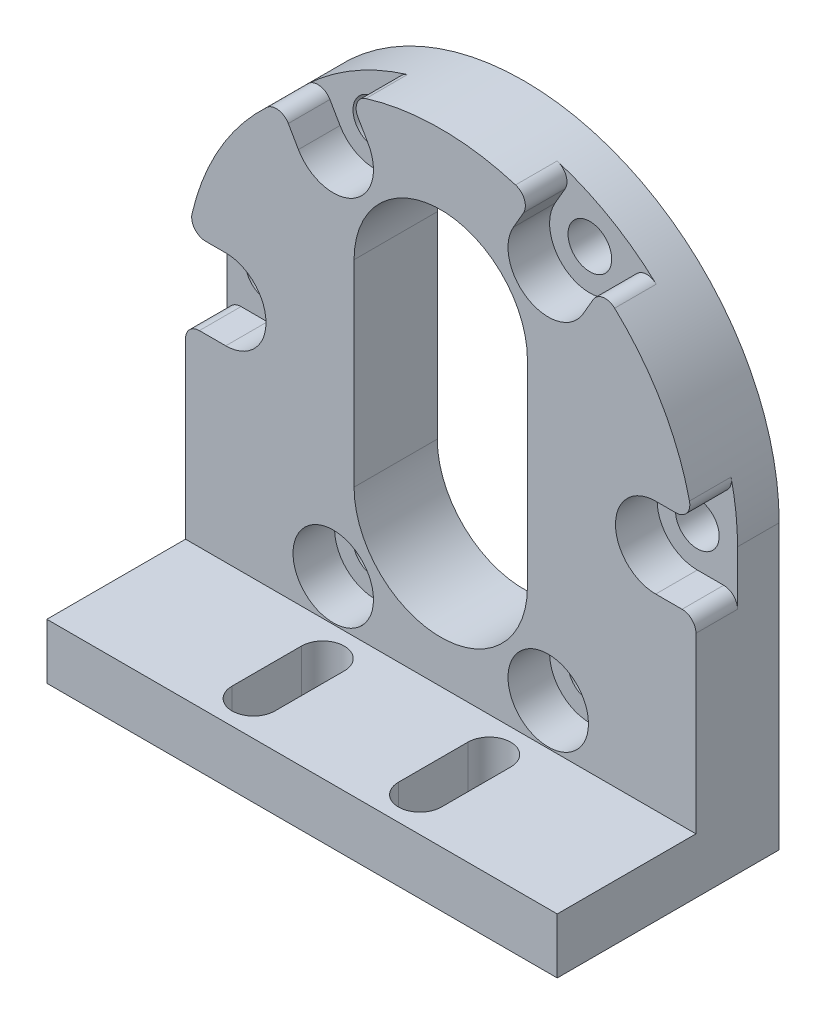
from build123d import *

# Parameters (mm, degrees)
SKETCH1_R           = 1.575
BOSS_EXTRUDE1_DEPTH = 6
CUT_EXTRUDE3_START  = -3
SKETCH2_R           = 2.9
SKETCH2_R_2         = 1.575
CUT_EXTRUDE3_DEPTH  = 3
CUT_EXTRUDE4_START  = -3
SKETCH2_3_R         = 2.9
SKETCH2_3_R_2       = 1.575
CUT_EXTRUDE4_DEPTH  = 3
SKETCH3_W           = 36.8
SKETCH3_H           = 4
BOSS_EXTRUDE2_DEPTH = 16
CUT_EXTRUDE5_DEPTH  = 10
FILLET2_R           = 1


with BuildPart() as part:
    # Sketch1 → Boss-Extrude1 (new body)
    # profile 1 of 2: a face of its own
    with BuildSketch(Plane.XY):
        with BuildLine():
            ThreePointArc((18.4, 0), (0, 18.4), (-18.4, 0))
            ThreePointArc((-18.4, 0), (0, -18.4), (18.4, 0))
        make_face()
        with Locations((-7.75, -13.423393759)):
            Circle(SKETCH1_R, mode=Mode.SUBTRACT)
        with Locations((7.75, -13.423393759)):
            Circle(SKETCH1_R, mode=Mode.SUBTRACT)
        with Locations((-15.5, 0)):
            Circle(SKETCH1_R, mode=Mode.SUBTRACT)
        with Locations((-7.75, 13.423393759)):
            Circle(SKETCH1_R, mode=Mode.SUBTRACT)
        with BuildLine():
            ThreePointArc((6.25, -7.1), (0, -13.35), (-6.25, -7.1))
            Line((-6.25, -7.1), (-6.25, 7.1))
            ThreePointArc((-6.25, 7.1), (0, 13.35), (6.25, 7.1))
            Line((6.25, 7.1), (6.25, -7.1))
        make_face(mode=Mode.SUBTRACT)
        with Locations((15.5, 0)):
            Circle(SKETCH1_R, mode=Mode.SUBTRACT)
        with Locations((7.75, 13.423393759)):
            Circle(SKETCH1_R, mode=Mode.SUBTRACT)
    # profile 2 of 2: a face of its own
    with BuildSketch(Plane.XY):
        with BuildLine():
            ThreePointArc((18.4, 0), (0, -18.4), (-18.4, 0))
            Line((-18.4, 0), (-18.4, -19))
            Line((-18.4, -19), (18.4, -19))
            Line((18.4, -19), (18.4, 0))
        make_face()
    extrude(amount=BOSS_EXTRUDE1_DEPTH)

    # Sketch2 → Cut-Extrude3 (cut)
    # profile 1 of 12: a face of its own
    with BuildSketch(Plane.XY.offset(6).offset(CUT_EXTRUDE3_START)):
        with Locations((-15.5, 0)):
            Circle(SKETCH2_R)
        with Locations((-15.5, 0)):
            Circle(SKETCH2_R_2, mode=Mode.SUBTRACT)
    # profile 2 of 12: a face of its own
    with BuildSketch(Plane.XY.offset(6).offset(CUT_EXTRUDE3_START)):
        with BuildLine():
            ThreePointArc((-18.4, 0), (-17.550609665, 2.050609665), (-15.5, 2.9))
            Line((-15.5, 2.9), (-18.17003027, 2.9))
            ThreePointArc((-18.17003027, 2.9), (-18.342417466, 1.454551999), (-18.4, 0))
        make_face()
    # profile 3 of 12: a face of its own
    with BuildSketch(Plane.XY.offset(6).offset(CUT_EXTRUDE3_START)):
        with BuildLine():
            ThreePointArc((-15.5, -2.9), (-17.550609665, -2.050609665), (-18.4, 0))
            Line((-18.4, 0), (-18.4, -2.9))
            Line((-18.4, -2.9), (-15.5, -2.9))
        make_face()
    # profile 4 of 12: a face of its own
    with BuildSketch(Plane.XY.offset(6).offset(CUT_EXTRUDE3_START)):
        with BuildLine():
            ThreePointArc((-6.573541464, 17.185707801), (-7.911529831, 16.612275453), (-9.200000154, 15.934867341))
            ThreePointArc((-9.200000154, 15.934867341), (-6.999424855, 16.224578678), (-5.238526329, 14.873393759))
            Line((-5.238526329, 14.873393759), (-6.573541464, 17.185707801))
        make_face()
    # profile 5 of 12: a face of its own
    with BuildSketch(Plane.XY.offset(6).offset(CUT_EXTRUDE3_START)):
        with BuildLine():
            ThreePointArc((-9.200000154, 15.934867341), (-10.430887789, 15.157723442), (-11.596488806, 14.285707801))
            Line((-11.596488806, 14.285707801), (-10.261473671, 11.973393759))
            ThreePointArc((-10.261473671, 11.973393759), (-10.551184919, 14.173968903), (-9.200000154, 15.934867341))
        make_face()
    # profile 6 of 12: a face of its own
    with BuildSketch(Plane.XY.offset(6).offset(CUT_EXTRUDE3_START)):
        with Locations((-7.75, 13.423393759)):
            Circle(SKETCH2_R)
        with Locations((-7.75, 13.423393759)):
            Circle(SKETCH2_R_2, mode=Mode.SUBTRACT)
    # profile 7 of 12: a face of its own
    with BuildSketch(Plane.XY.offset(6).offset(CUT_EXTRUDE3_START)):
        with BuildLine():
            ThreePointArc((9.200000155, 15.93486734), (7.911529831, 16.612275453), (6.573541464, 17.185707801))
            Line((6.573541464, 17.185707801), (5.238526329, 14.873393759))
            ThreePointArc((5.238526329, 14.873393759), (6.999424856, 16.224578678), (9.200000155, 15.93486734))
        make_face()
    # profile 8 of 12: a face of its own
    with BuildSketch(Plane.XY.offset(6).offset(CUT_EXTRUDE3_START)):
        with Locations((7.75, 13.423393759)):
            Circle(SKETCH2_R)
        with Locations((7.75, 13.423393759)):
            Circle(SKETCH2_R_2, mode=Mode.SUBTRACT)
    # profile 9 of 12: a face of its own
    with BuildSketch(Plane.XY.offset(6).offset(CUT_EXTRUDE3_START)):
        with BuildLine():
            ThreePointArc((11.596488806, 14.285707801), (10.430887789, 15.157723441), (9.200000155, 15.93486734))
            ThreePointArc((9.200000155, 15.93486734), (10.261473716, 14.873393681), (10.65, 13.423393759))
            ThreePointArc((10.65, 13.423393759), (10.551184896, 12.672818528), (10.261473671, 11.973393759))
            Line((10.261473671, 11.973393759), (11.596488806, 14.285707801))
        make_face()
    # profile 10 of 12: a face of its own
    with BuildSketch(Plane.XY.offset(6).offset(CUT_EXTRUDE3_START)):
        with BuildLine():
            ThreePointArc((18.4, 0), (18.342417466, 1.454551999), (18.17003027, 2.9))
            Line((18.17003027, 2.9), (15.5, 2.9))
            ThreePointArc((15.5, 2.9), (17.550609665, 2.050609665), (18.4, 0))
        make_face()
    # profile 11 of 12: a face of its own
    with BuildSketch(Plane.XY.offset(6).offset(CUT_EXTRUDE3_START)):
        with Locations((15.5, 0)):
            Circle(SKETCH2_R)
        with Locations((15.5, 0)):
            Circle(SKETCH2_R_2, mode=Mode.SUBTRACT)
    # profile 12 of 12: a face of its own
    with BuildSketch(Plane.XY.offset(6).offset(CUT_EXTRUDE3_START)):
        with BuildLine():
            Line((18.4, -2.9), (18.4, 0))
            ThreePointArc((18.4, 0), (17.550609665, -2.050609665), (15.5, -2.9))
            Line((15.5, -2.9), (18.4, -2.9))
        make_face()
    extrude(amount=CUT_EXTRUDE3_DEPTH, mode=Mode.SUBTRACT)

    # Sketch2<3> → Cut-Extrude4 (cut)
    # profile 1 of 2: a face of its own
    with BuildSketch(Plane.XY.offset(6).offset(CUT_EXTRUDE4_START)):
        with Locations((7.75, -13.423393759)):
            Circle(SKETCH2_3_R)
        with Locations((7.75, -13.423393759)):
            Circle(SKETCH2_3_R_2, mode=Mode.SUBTRACT)
    # profile 2 of 2: a face of its own
    with BuildSketch(Plane.XY.offset(6).offset(CUT_EXTRUDE4_START)):
        with Locations((-7.75, -13.423393759)):
            Circle(SKETCH2_3_R)
    extrude(amount=CUT_EXTRUDE4_DEPTH, mode=Mode.SUBTRACT)

    # Sketch3 → Boss-Extrude2 (add)
    with BuildSketch(Plane.XY):
        with Locations((0, -18.423393759)):
            Rectangle(SKETCH3_W, SKETCH3_H)
    extrude(amount=BOSS_EXTRUDE2_DEPTH)

    # Sketch4 → Cut-Extrude5 (cut)
    with BuildSketch(Plane(origin=(0, -16.423393759, 0), x_dir=(1, 0, 0), z_dir=(0, 1, 0))):
        with BuildLine():
            Line((-4.45, -8.5), (-4.45, -13.5))
            ThreePointArc((-4.45, -13.5), (-6, -15.05), (-7.55, -13.5))
            Line((-7.55, -13.5), (-7.55, -8.5))
            ThreePointArc((-7.55, -8.5), (-6, -6.95), (-4.45, -8.5))
        make_face()
        with BuildLine():
            Line((4.45, -8.5), (4.45, -13.5))
            ThreePointArc((4.45, -13.5), (6, -15.05), (7.55, -13.5))
            Line((7.55, -13.5), (7.55, -8.5))
            ThreePointArc((7.55, -8.5), (6, -6.95), (4.45, -8.5))
        make_face()
    extrude(amount=-CUT_EXTRUDE5_DEPTH, mode=Mode.SUBTRACT)

    # Fillet2
    fillet2_edges = [part.edges().sort_by_distance(p)[0] for p in [
        (-18.4, -2.9, 4.5),
        (-18.17003027, 2.9, 4.5),
        (-11.596488806, 14.285707801, 4.5),
        (-6.573541464, 17.185707801, 4.5),
        (6.573541464, 17.185707801, 4.5),
        (11.596488806, 14.285707801, 4.5),
        (18.17003027, 2.9, 4.5),
        (18.4, -2.9, 4.5),
    ]]
    fillet(fillet2_edges, radius=FILLET2_R)


solid = part.part
